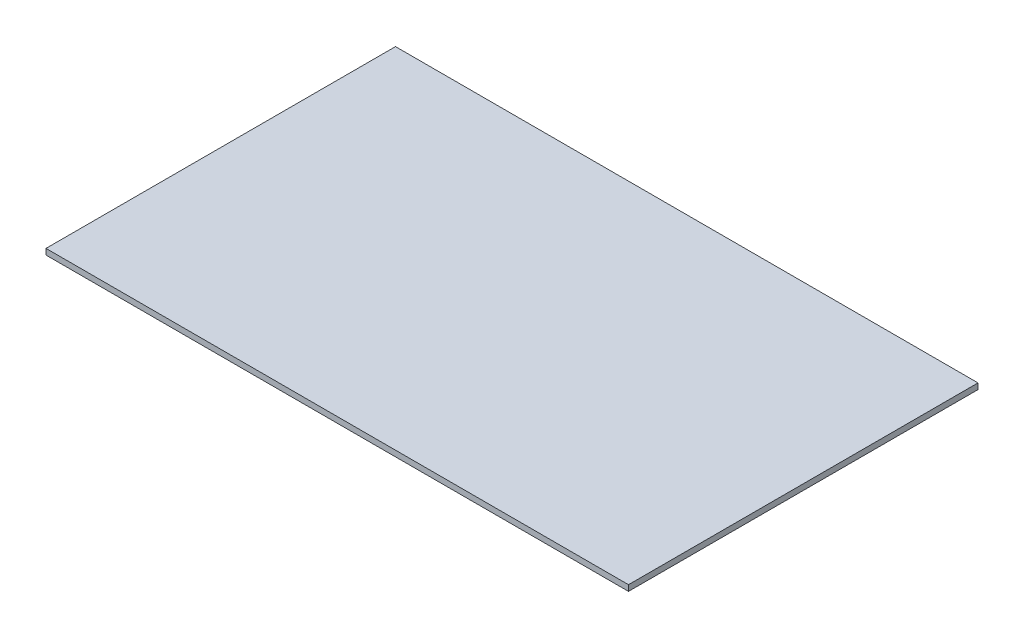
from build123d import *

# Parameters (mm, degrees)
SKETCH1_W           = 500
SKETCH1_H           = 300
BOSS_EXTRUDE1_DEPTH = 5


with BuildPart() as part:
    # Sketch1 → Boss-Extrude1 (new body)
    with BuildSketch(Plane(origin=(0, 0, 0), x_dir=(1, 0, 0), z_dir=(0, 1, 0))):
        Rectangle(SKETCH1_W, SKETCH1_H)
    extrude(amount=BOSS_EXTRUDE1_DEPTH)


solid = part.part
